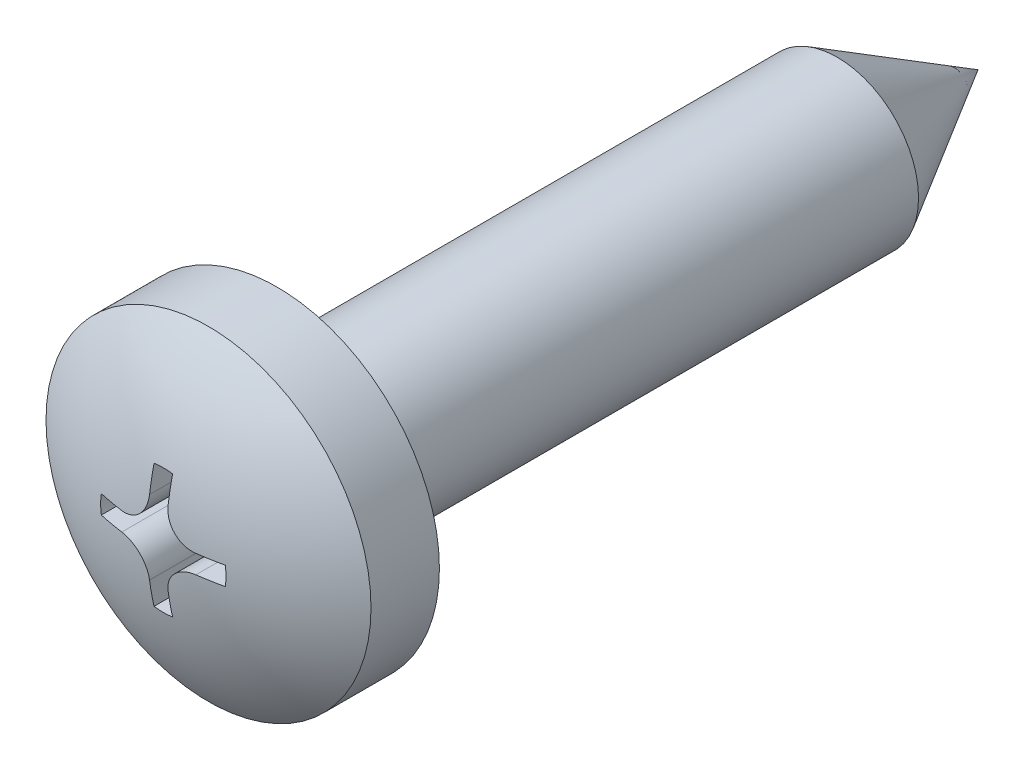
from build123d import *

# Parameters (mm, degrees)
CUT_EXTRUDE_2_DEPTH = 1.55
FILLET_1_R          = 0.1


with BuildPart() as part:
    # 草图8 → Revolve 1380 (revolve)
    with BuildSketch(Plane(origin=(0, 0, 0), x_dir=(0, 0, -1), z_dir=(1, 0, 0)), mode=Mode.PRIVATE) as revolve_1380_sk:
        with BuildLine():
            Line((0, 0), (-17.7, 0))
            ThreePointArc((-17.7, 0), (-17.411408891, 1.838425545), (-16.573397172, 3.5))
            Line((-16.573397172, 3.5), (-15.1, 3.5))
            Line((-15.1, 3.5), (-15.1, 1.75))
            Line((-15.1, 1.75), (-3.031088913, 1.75))
            Line((-3.031088913, 1.75), (0, 0))
        make_face()
    revolve(revolve_1380_sk.sketch.rotate(Axis((0, 0, 11.71), (0, 0, -1)), 90), axis=Axis((0, 0, 11.71), (0, 0, -1)))

    # 草图7 → 切除-拉伸2 (cut)
    with BuildSketch(Plane.XY.offset(17.7)):
        with BuildLine():
            Line((0.2, 1.335102992), (0.2, 0.797500009))
            ThreePointArc((0.2, 0.797500009), (0.375003701, 0.375003701), (0.797500009, 0.2))
            Line((0.797500009, 0.2), (1.335102992, 0.2))
            ThreePointArc((1.335102992, 0.2), (1.35, 0), (1.335102992, -0.2))
            Line((1.335102992, -0.2), (0.797500009, -0.2))
            ThreePointArc((0.797500009, -0.2), (0.375003701, -0.375003701), (0.2, -0.797500009))
            Line((0.2, -0.797500009), (0.2, -1.335102992))
            ThreePointArc((0.2, -1.335102992), (0, -1.35), (-0.2, -1.335102992))
            Line((-0.2, -1.335102992), (-0.2, -0.797500009))
            ThreePointArc((-0.2, -0.797500009), (-0.375003701, -0.375003701), (-0.797500009, -0.2))
            Line((-0.797500009, -0.2), (-1.335102992, -0.2))
            ThreePointArc((-1.335102992, -0.2), (-1.35, 0), (-1.335102992, 0.2))
            Line((-1.335102992, 0.2), (-0.797500009, 0.2))
            ThreePointArc((-0.797500009, 0.2), (-0.375003701, 0.375003701), (-0.2, 0.797500009))
            Line((-0.2, 0.797500009), (-0.2, 1.335102992))
            ThreePointArc((-0.2, 1.335102992), (0, 1.35), (0.2, 1.335102992))
        make_face()
    extrude(amount=-CUT_EXTRUDE_2_DEPTH, mode=Mode.SUBTRACT)

    # 圆角1
    fillet_1_edges = [part.edges().sort_by_distance(p)[0] for p in [
        (-1.75, 0, 15.1),
    ]]
    fillet(fillet_1_edges, radius=FILLET_1_R)


solid = part.part
